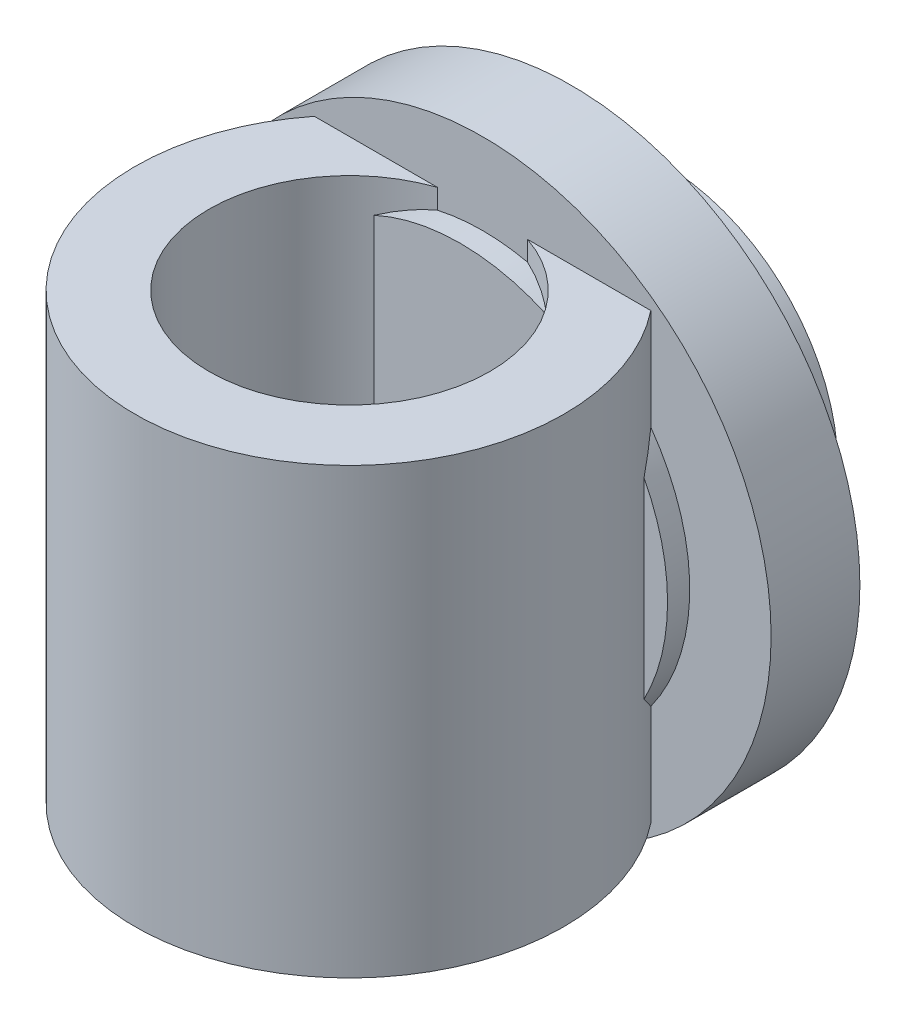
from build123d import *

# Parameters (mm, degrees)
SKETCH_1_R           = 47
EXTRUDE_1_DEPTH      = 25
SKETCH_2_R           = 78
EXTRUDE_2_DEPTH      = 24
SKETCH_3_R           = 56
EXTRUDE_3_DEPTH      = 30
EXTRUDE_4_DEPTH      = 60
EXTRUDE_4_DEPTH_BACK = 60
SKETCH_4_R           = 58
SKETCH_4_R_2         = 38


with BuildPart() as part:
    # 草图1 → 凸台-拉伸1 (new body)
    with BuildSketch(Plane.XY):
        Circle(SKETCH_1_R)
    extrude(amount=-EXTRUDE_1_DEPTH)

    # 草图2 → 凸台-拉伸2 (add)
    with BuildSketch(Plane.XY):
        Circle(SKETCH_2_R)
    extrude(amount=EXTRUDE_2_DEPTH)

    # 草图3 → 凸台-拉伸3 (add)
    with BuildSketch(Plane.XY):
        Circle(SKETCH_3_R)
    extrude(amount=EXTRUDE_3_DEPTH)

    # 草图4 → 凸台-拉伸4 (add, two sides: drawn at the far end of the back side and taken through both)
    with BuildSketch(Plane(origin=(0, 0, 0), x_dir=(1, 0, 0), z_dir=(0, 1, 0)).offset(-EXTRUDE_4_DEPTH_BACK)):
        with Locations((0, -60)):
            Circle(SKETCH_4_R)
        with Locations((0, -60)):
            Circle(SKETCH_4_R_2, mode=Mode.SUBTRACT)
    extrude(amount=EXTRUDE_4_DEPTH + EXTRUDE_4_DEPTH_BACK)


solid = part.part
